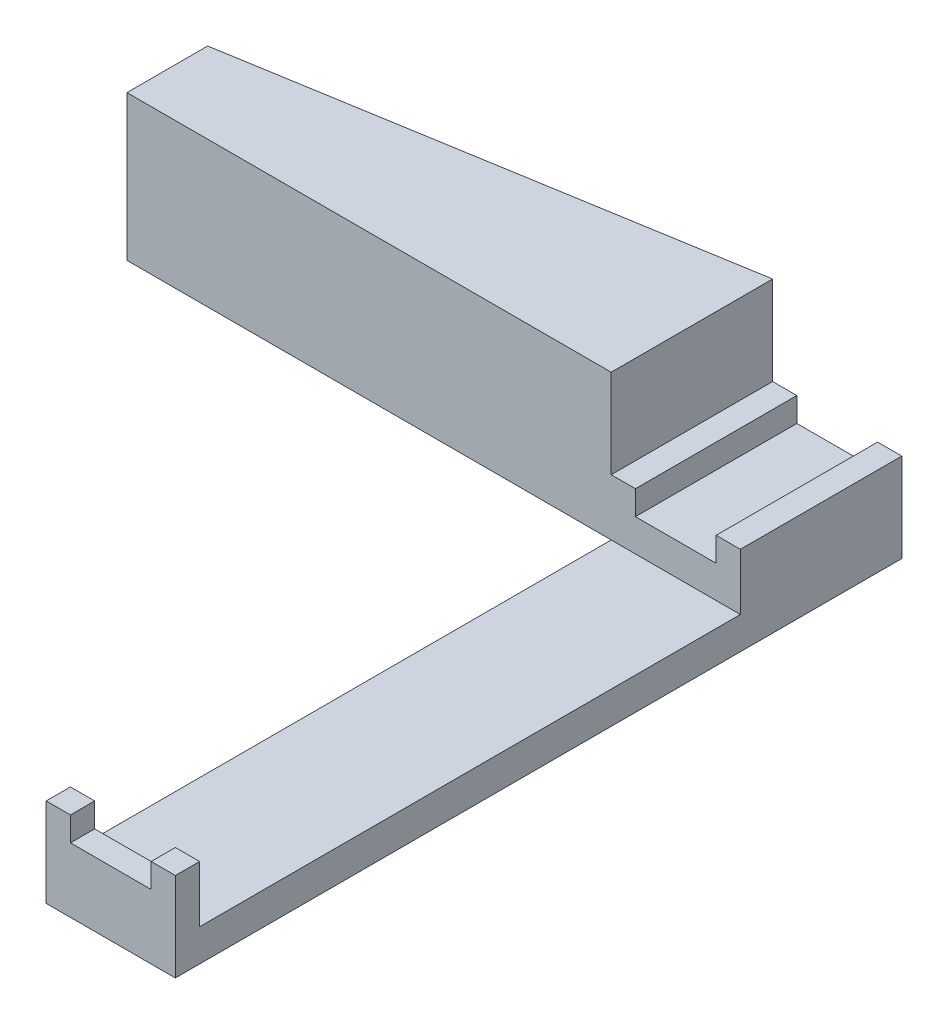
from build123d import *

# Parameters (mm, degrees)
BOSS_EXTRUDE1_DEPTH = 12
SKETCH2_W           = 8
SKETCH2_H           = 33.5
CUT_EXTRUDE1_DEPTH  = 10
SKETCH3_W           = 8
SKETCH3_H           = 45
CUT_EXTRUDE2_DEPTH  = 6.5
SKETCH4_W           = 5
SKETCH4_H           = 10
CUT_EXTRUDE3_DEPTH  = 1.5
SKETCH5_W           = 5
SKETCH5_H           = 1.5
CUT_EXTRUDE4_DEPTH  = 1.5
CUT_EXTRUDE5_DEPTH  = 2
CUT_EXTRUDE7_DEPTH  = 1
CUT_EXTRUDE9_DEPTH  = 3


with BuildPart() as part:
    # Sketch1 → Boss-Extrude1 (new body)
    with BuildSketch(Plane(origin=(0, 0, 0), x_dir=(1, 0, 0), z_dir=(0, 1, 0))):
        Polygon((0, 0), (30, 0), (30, -35), (38, -35), (38, 10), (30, 10), (0, 5), align=None)
    extrude(amount=BOSS_EXTRUDE1_DEPTH)

    # Sketch2 → Cut-Extrude1 (cut)
    with BuildSketch(Plane(origin=(0, 12, 0), x_dir=(1, 0, 0), z_dir=(0, 1, 0))):
        with Locations((34, -16.75)):
            Rectangle(SKETCH2_W, SKETCH2_H)
    extrude(amount=-CUT_EXTRUDE1_DEPTH, mode=Mode.SUBTRACT)

    # Sketch3 → Cut-Extrude2 (cut)
    with BuildSketch(Plane(origin=(0, 12, 0), x_dir=(1, 0, 0), z_dir=(0, 1, 0))):
        with Locations((34, -12.5)):
            Rectangle(SKETCH3_W, SKETCH3_H)
    extrude(amount=-CUT_EXTRUDE2_DEPTH, mode=Mode.SUBTRACT)

    # Sketch4 → Cut-Extrude3 (cut)
    with BuildSketch(Plane(origin=(0, 5.5, 0), x_dir=(1, 0, 0), z_dir=(0, 1, 0))):
        with Locations((34, 5)):
            Rectangle(SKETCH4_W, SKETCH4_H)
    extrude(amount=-CUT_EXTRUDE3_DEPTH, mode=Mode.SUBTRACT)

    # Sketch5 → Cut-Extrude4 (cut)
    with BuildSketch(Plane(origin=(0, 5.5, 0), x_dir=(1, 0, 0), z_dir=(0, 1, 0))):
        with Locations((34, -34.25)):
            Rectangle(SKETCH5_W, SKETCH5_H)
    extrude(amount=-CUT_EXTRUDE4_DEPTH, mode=Mode.SUBTRACT)

    # Sketch6 → Cut-Extrude5 (cut)
    with BuildSketch(Plane.XZ):
        Polygon((0, 0), (30, 0), (30, -10), (0, -5), align=None)
    extrude(amount=-CUT_EXTRUDE5_DEPTH, mode=Mode.SUBTRACT)

    # Sketch7 → Cut-Extrude7 (cut)
    with BuildSketch(Plane(origin=(0, 12, 0), x_dir=(1, 0, 0), z_dir=(0, 1, 0))):
        Polygon((0, 5), (30, 10), (30, 0), (0, 0), align=None)
    extrude(amount=-CUT_EXTRUDE7_DEPTH, mode=Mode.SUBTRACT)

    # Sketch10 → Cut-Extrude9 (cut)
    with BuildSketch(Plane.XZ.offset(-2)):
        Polygon((0, -5), (30, -10), (30, -3), (0, -3), align=None)
    extrude(amount=-CUT_EXTRUDE9_DEPTH, mode=Mode.SUBTRACT)


solid = part.part
